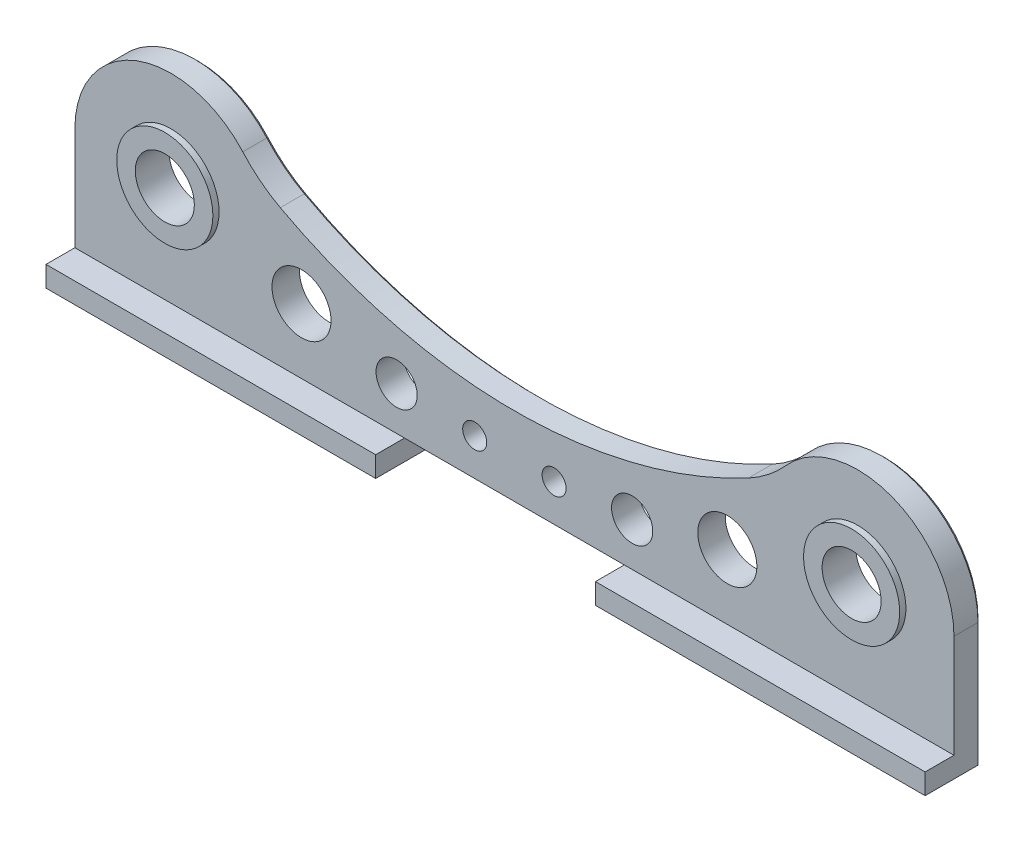
from build123d import *

# Parameters (mm, degrees)
BOSS_EXTRUDE1_DEPTH = 4
SKETCH6_R           = 7
BOSS_EXTRUDE2_DEPTH = 0.9
SKETCH7_R           = 4.3
CUT_EXTRUDE1_DEPTH  = 20
FILLET1_R           = 20
SKETCH8_W           = 64
SKETCH8_H           = 3
BOSS_EXTRUDE3_DEPTH = 4.2
SKETCH10_W          = 16
SKETCH10_H          = 3
CUT_EXTRUDE2_DEPTH  = 20
SKETCH11_R          = 4.3
SKETCH11_R_2        = 3
SKETCH11_R_3        = 1.75
CUT_EXTRUDE3_DEPTH  = 20
CHAMFER1_SIZE       = 0.5


with BuildPart() as part:
    # Sketch3 → Boss-Extrude1 (new body)
    with BuildSketch(Plane.XY):
        with BuildLine():
            Line((-64, -73.627440537), (-64, -91.627440537))
            Line((-64, -91.627440537), (0, -91.627440537))
            Line((0, -91.627440537), (0, -77.201334505))
            ThreePointArc((0, -77.201334505), (-19.791335437, -74.427796509), (-38.057892518, -66.320863438))
            ThreePointArc((-38.057892518, -66.320863438), (-53.795424565, -60.15173082), (-64, -73.627440537))
        make_face()
    extrude(amount=BOSS_EXTRUDE1_DEPTH)

    # Sketch6 → Boss-Extrude2 (add)
    with BuildSketch(Plane.XY.offset(4)):
        with Locations((-50, -73.627440537)):
            Circle(SKETCH6_R)
    extrude(amount=BOSS_EXTRUDE2_DEPTH)

    # Sketch7 → Cut-Extrude1 (cut)
    with BuildSketch(Plane.XY.offset(4.9)):
        with Locations((-50, -73.627440537)):
            Circle(SKETCH7_R)
    extrude(amount=-CUT_EXTRUDE1_DEPTH, mode=Mode.SUBTRACT)

    # Fillet1
    fillet1_edges = [part.edges().sort_by_distance(p)[0] for p in [
        (-38.057892518, -66.320863438, 2),
    ]]
    fillet(fillet1_edges, radius=FILLET1_R)

    # Sketch8 → Boss-Extrude3 (add)
    with BuildSketch(Plane.XY.offset(4)):
        with Locations((-32, -90.127440537)):
            Rectangle(SKETCH8_W, SKETCH8_H)
    extrude(amount=BOSS_EXTRUDE3_DEPTH)

    # Sketch10 → Cut-Extrude2 (cut)
    with BuildSketch(Plane.XY.offset(8.2)):
        with Locations((-8, -90.127440537)):
            Rectangle(SKETCH10_W, SKETCH10_H)
    extrude(amount=-CUT_EXTRUDE2_DEPTH, mode=Mode.SUBTRACT)

    # Sketch11 → Cut-Extrude3 (cut)
    with BuildSketch(Plane.XY.offset(4)):
        with Locations((-31, -79.186135246)):
            Circle(SKETCH11_R)
        with Locations((-17.14802046, -82.330394565)):
            Circle(SKETCH11_R_2)
        with Locations((-5.779829741, -83.233322768)):
            Circle(SKETCH11_R_3)
    extrude(amount=-CUT_EXTRUDE3_DEPTH, mode=Mode.SUBTRACT)

    # Mirror1: part across plane


with BuildPart() as part_1:
    add(part.part)
    add(part.part.mirror(Plane(origin=(0, -91.627440537, 4), x_dir=(0, 0, 1), z_dir=(-1, 0, 0))))

    # Chamfer1
    chamfer1_edges = [part_1.edges().sort_by_distance(p)[0] for p in [
        (-54.98433008, -60.544762919, 0),
        (0, -77.201334505, 0),
        (-37.007349735, -66.705508667, 0),
        (0, -88.627440537, 0),
        (-16, -90.127440537, 0),
        (-40, -91.627440537, 0),
        (-64, -82.627440537, 0),
        (54.98433008, -60.544762919, 0),
        (64, -82.627440537, 0),
        (40, -91.627440537, 0),
        (37.007349735, -66.705508667, 0),
        (16, -90.127440537, 0),
    ]]
    chamfer(chamfer1_edges, length=CHAMFER1_SIZE)


solid = part_1.part
